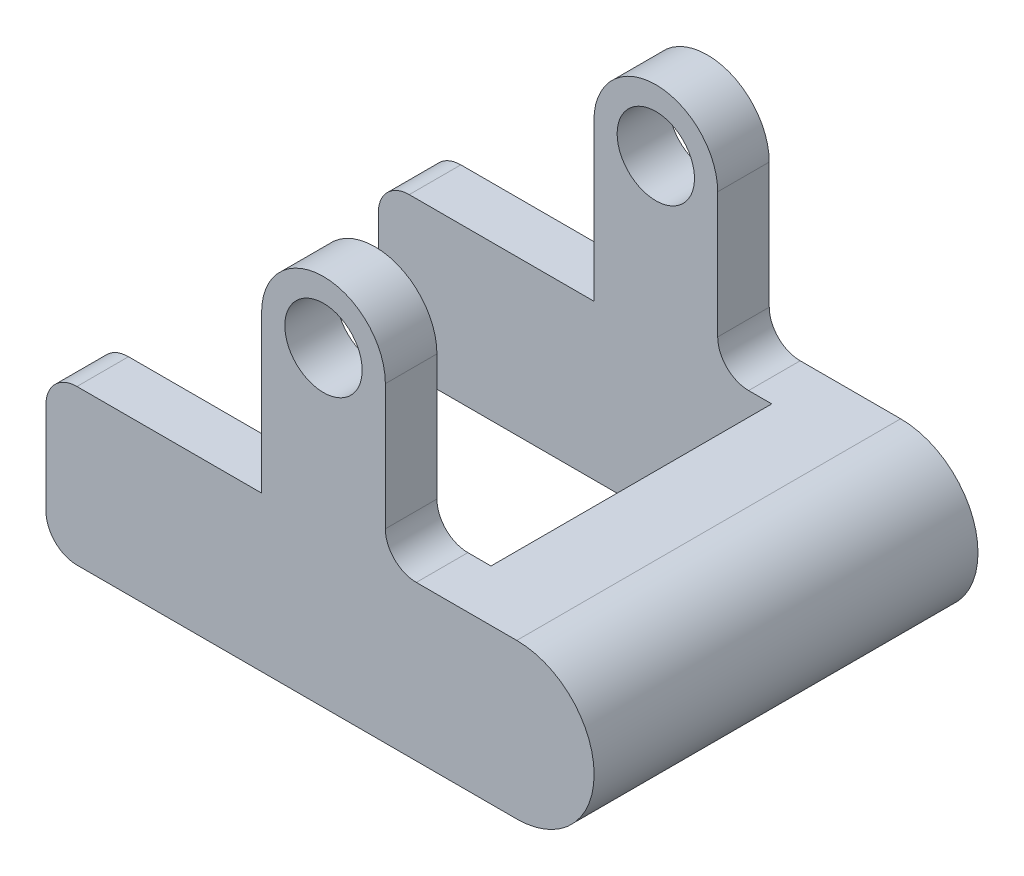
from build123d import *

# Parameters (mm, degrees)
SKETCH1_R           = 18.75
SKETCH1_W           = 104.5375
SKETCH1_H           = 75
BOSS_EXTRUDE1_DEPTH = 25
SKETCH2_R           = 18.75
BOSS_EXTRUDE2_DEPTH = 25
SKETCH3_W           = 75
SKETCH3_H           = 75
BOSS_EXTRUDE3_DEPTH = 136.125
FILLET1_RADIUS      = 37.5
FILLET1_LENGTH      = 186.125
FILLET2_R           = 15


with BuildPart() as part:
    # Sketch1 → Boss-Extrude1 (new body)
    # profile 1 of 3: a face of its own
    with BuildSketch(Plane.XY):
        with BuildLine():
            Line((-986.2125, 179.805377859), (-825, 179.805377859))
            Line((-825, 179.805377859), (-825, 254.805377859))
            Line((-825, 254.805377859), (-926.2125, 254.805377859))
            Line((-926.2125, 254.805377859), (-926.2125, 330.75))
            ThreePointArc((-926.2125, 330.75), (-956.2125, 360.75), (-986.2125, 330.75))
            Line((-986.2125, 330.75), (-986.2125, 254.805377859))
            Line((-986.2125, 254.805377859), (-986.2125, 179.805377859))
        make_face()
        with Locations((-956.2125, 330.75)):
            Circle(SKETCH1_R, mode=Mode.SUBTRACT)
    # profile 2 of 3: a face of its own
    with BuildSketch(Plane.XY):
        with BuildLine():
            Line((-986.2125, 179.805377859), (-825, 179.805377859))
            Line((-825, 179.805377859), (-825, 254.805377859))
            Line((-825, 254.805377859), (-926.2125, 254.805377859))
            Line((-926.2125, 254.805377859), (-926.2125, 330.75))
            ThreePointArc((-926.2125, 330.75), (-956.2125, 360.75), (-986.2125, 330.75))
            Line((-986.2125, 330.75), (-986.2125, 254.805377859))
            Line((-986.2125, 254.805377859), (-986.2125, 179.805377859))
        make_face()
        with Locations((-956.2125, 330.75)):
            Circle(SKETCH1_R, mode=Mode.SUBTRACT)
    # profile 3 of 3: a face of its own
    with BuildSketch(Plane.XY):
        with Locations((-1038.48125, 217.305377859)):
            Rectangle(SKETCH1_W, SKETCH1_H)
    extrude(amount=BOSS_EXTRUDE1_DEPTH)



with BuildPart() as body_2:
    # Sketch2 → Boss-Extrude2 (new body)
    with BuildSketch(Plane(origin=(0, 0, -136.125), x_dir=(-1, 0, 0), z_dir=(0, 0, -1))):
        with BuildLine():
            Line((926.2125, 330.75), (926.2125, 254.805377859))
            Line((926.2125, 254.805377859), (825, 254.805377859))
            Line((825, 254.805377859), (825, 179.805377859))
            Line((825, 179.805377859), (1090.75, 179.805377859))
            Line((1090.75, 179.805377859), (1090.75, 254.805377859))
            Line((1090.75, 254.805377859), (986.2125, 254.805377859))
            Line((986.2125, 254.805377859), (986.2125, 330.75))
            ThreePointArc((986.2125, 330.75), (956.2125, 360.75), (926.2125, 330.75))
        make_face()
        with Locations(Location((956.2125, 330.75, 0), (0, 0, 180))):
            Circle(SKETCH2_R, mode=Mode.SUBTRACT)
    extrude(amount=BOSS_EXTRUDE2_DEPTH)


with BuildPart() as part_1:
    add(part.part)

    add(body_2.part)  # Boss-Extrude3 merges body 2
    # Sketch3 → Boss-Extrude3 (add)
    with BuildSketch(Plane.XY.offset(-136.125)):
        with Locations((-862.5, 217.305377859)):
            Rectangle(SKETCH3_W, SKETCH3_H)
    extrude(amount=BOSS_EXTRUDE3_DEPTH)

    # Fillet1: full round fillet: the end face becomes a half cylinder, R = half its width
    fillet1_face = Plane((-825, 217.305377859, -68.0625), x_dir=(0, 0, 1), z_dir=(1, 0, 0))  # on the end face: x along it, z out of the body
    fillet1_slab = fillet1_face.offset(-FILLET1_RADIUS / 2) * Box(FILLET1_LENGTH, 2 * FILLET1_RADIUS, FILLET1_RADIUS, mode=Mode.PRIVATE)  # the body's end, R deep
    fillet1_round = Plane((-862.5, 217.305377859, -68.0625), x_dir=(1, 0, 0), z_dir=(0, 0, 1)) * Cylinder(FILLET1_RADIUS, FILLET1_LENGTH, mode=Mode.PRIVATE)  # its axis R under the face
    add(fillet1_slab - fillet1_round, mode=Mode.SUBTRACT)

    # Fillet2
    fillet2_edges = [part_1.edges().sort_by_distance(p)[0] for p in [
        (-926.2125, 254.805377859, 12.5),
        (-1090.75, 179.805377859, 12.5),
        (-1090.75, 254.805377859, 12.5),
        (-926.2125, 254.805377859, -148.625),
        (-1090.75, 179.805377859, -148.625),
        (-1090.75, 254.805377859, -148.625),
    ]]
    fillet(fillet2_edges, radius=FILLET2_R)


solid = part_1.part
